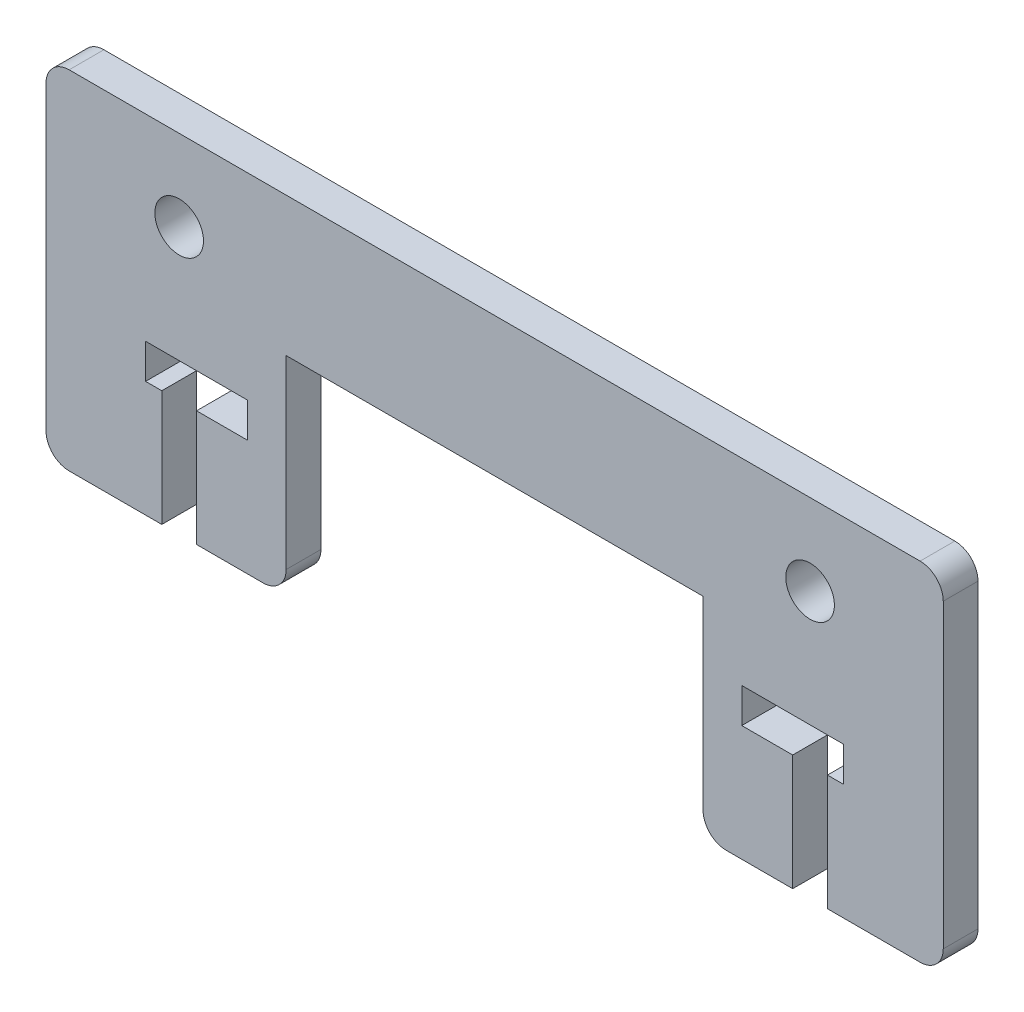
from build123d import *

# Parameters (mm, degrees)
SKETCH_1_R      = 1.05
EXTRUDE_1_DEPTH = 1.5
FILLET_1_R      = 1


with BuildPart() as part:
    # 草图1 → 凸台-拉伸1 (new body)
    with BuildSketch(Plane.XY):
        Polygon((23.32, 41.958612035), (27.19, 41.958612035), (27.19, 46.958612035), (24.99, 46.958612035), (24.99, 48.458612035), (29.39, 48.458612035), (29.39, 46.958612035), (28.69, 46.958612035), (28.69, 41.958612035), (33.69, 41.958612035), (33.69, 56.958612035), (14.32, 56.958612035), (-5.05, 56.958612035), (-5.05, 41.958612035), (-0.05, 41.958612035), (-0.05, 46.958612035), (-0.75, 46.958612035), (-0.75, 48.458612035), (3.65, 48.458612035), (3.65, 46.958612035), (1.45, 46.958612035), (1.45, 41.958612035), (5.32, 41.958612035), (5.32, 50.958612035), (23.32, 50.958612035), align=None)
        with Locations((27.94, 53.458612035)):
            Circle(SKETCH_1_R, mode=Mode.SUBTRACT)
        with Locations(Location((0.7, 53.458612035, 0), (0, 0, 180))):
            Circle(SKETCH_1_R, mode=Mode.SUBTRACT)
    extrude(amount=EXTRUDE_1_DEPTH)

    # 圆角1
    fillet_1_edges = [part.edges().sort_by_distance(p)[0] for p in [
        (-5.05, 41.958612035, 0.75),
        (-5.05, 56.958612035, 0.75),
        (33.69, 56.958612035, 0.75),
        (33.69, 41.958612035, 0.75),
        (23.32, 41.958612035, 0.75),
        (5.32, 41.958612035, 0.75),
    ]]
    fillet(fillet_1_edges, radius=FILLET_1_R)


solid = part.part
